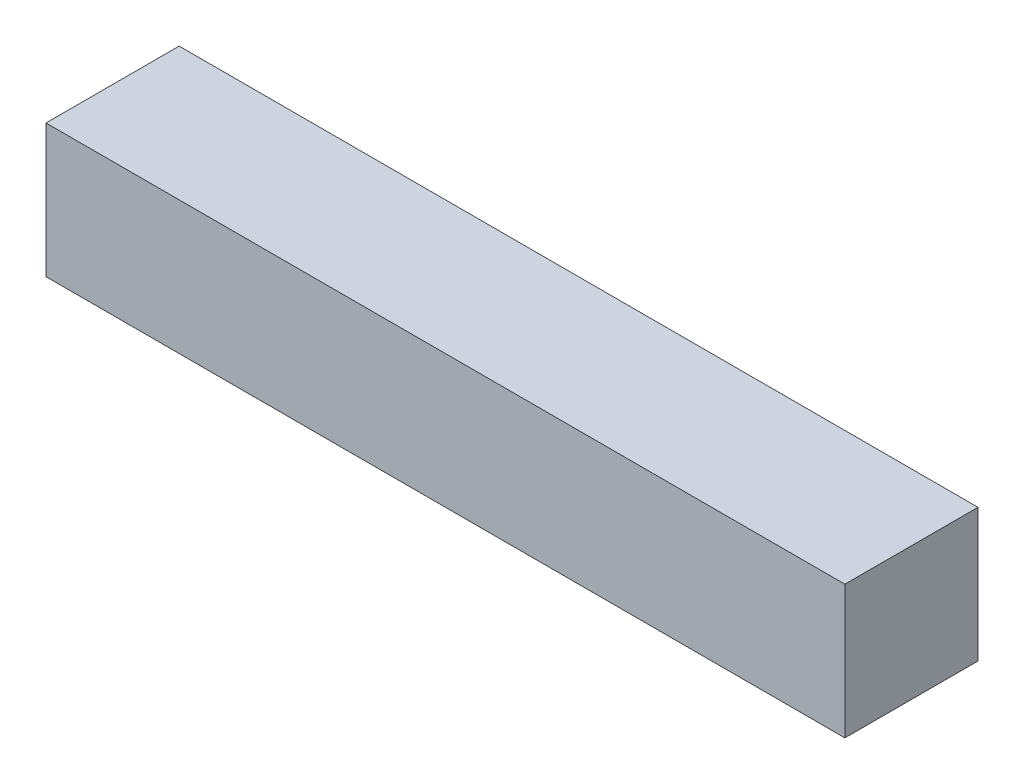
from build123d import *

# Parameters (mm, degrees)
SKETCH_1_W      = 420
SKETCH_1_H      = 70
EXTRUDE_1_DEPTH = 70


with BuildPart() as part:
    # 草图1 → 凸台-拉伸1 (new body)
    with BuildSketch(Plane.XY):
        Rectangle(SKETCH_1_W, SKETCH_1_H)
    extrude(amount=EXTRUDE_1_DEPTH)


solid = part.part
